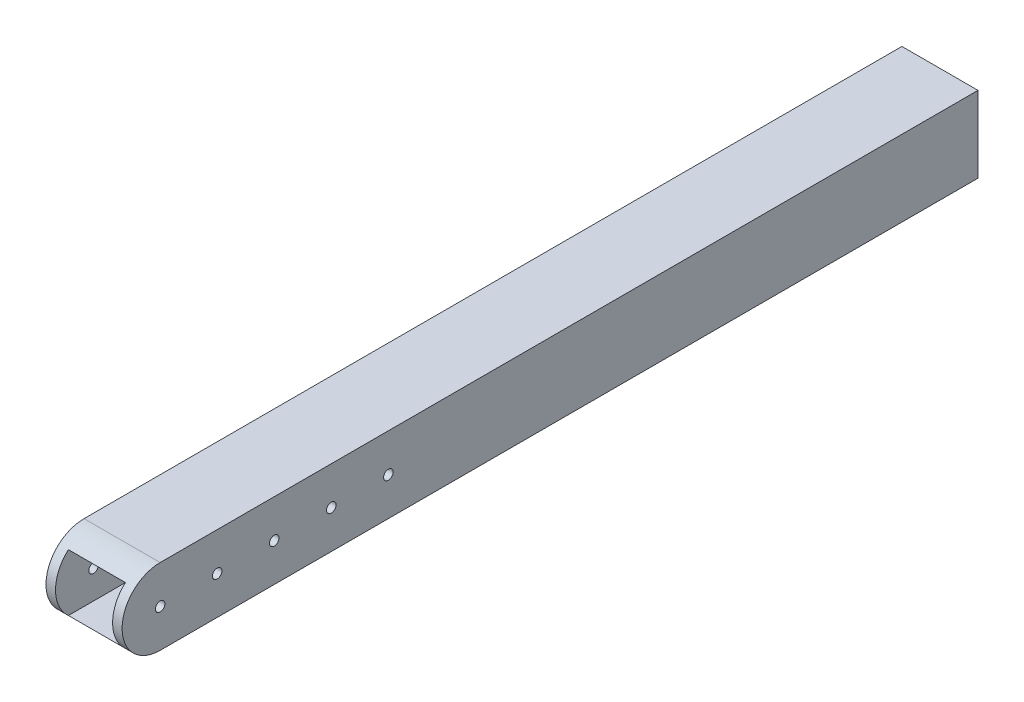
from build123d import *

# Parameters (mm, degrees)
SKETCH1_W           = 40
SKETCH1_H           = 40
SKETCH1_W_2         = 30
SKETCH1_H_2         = 30
BOSS_EXTRUDE1_DEPTH = 450
SKETCH2_R           = 2.5
CUT_EXTRUDE1_DEPTH  = 450
CUT_EXTRUDE2_DEPTH  = 76
LPATTERN1_COUNT     = 5
LPATTERN1_PITCH     = 30


with BuildPart() as part:
    # Sketch1 → Boss-Extrude1 (new body)
    with BuildSketch(Plane.XY):
        Rectangle(SKETCH1_W, SKETCH1_H)
        Rectangle(SKETCH1_W_2, SKETCH1_H_2, mode=Mode.SUBTRACT)
    extrude(amount=BOSS_EXTRUDE1_DEPTH)

    # Sketch2 → Cut-Extrude1 (cut)
    with BuildSketch(Plane(origin=(20, 0, 0), x_dir=(0, 0, -1), z_dir=(1, 0, 0))):
        with Locations((-430, 0)):
            Circle(SKETCH2_R)
    cut_extrude1 = extrude(amount=-CUT_EXTRUDE1_DEPTH, mode=Mode.SUBTRACT)

    # Sketch3 → Cut-Extrude2 (cut)
    with BuildSketch(Plane(origin=(20, 0, 0), x_dir=(0, 0, -1), z_dir=(1, 0, 0))):
        with BuildLine():
            ThreePointArc((-450, 2.8e-07), (-444.142135525, 14.142135723), (-430, 20))
            Line((-430, 20), (-450, 20))
            Line((-450, 20), (-450, 2.8e-07))
        make_face()
        with BuildLine():
            ThreePointArc((-430, -20), (-444.142135723, -14.142135525), (-450, 2.8e-07))
            Line((-450, 2.8e-07), (-450, -20))
            Line((-450, -20), (-430, -20))
        make_face()
    extrude(amount=-CUT_EXTRUDE2_DEPTH, mode=Mode.SUBTRACT)

    # LPattern1: Cut-Extrude1 ×5
    with Locations(*[(0, 0, -i * LPATTERN1_PITCH) for i in range(1, LPATTERN1_COUNT)]):
        add(cut_extrude1, mode=Mode.SUBTRACT)


solid = part.part
